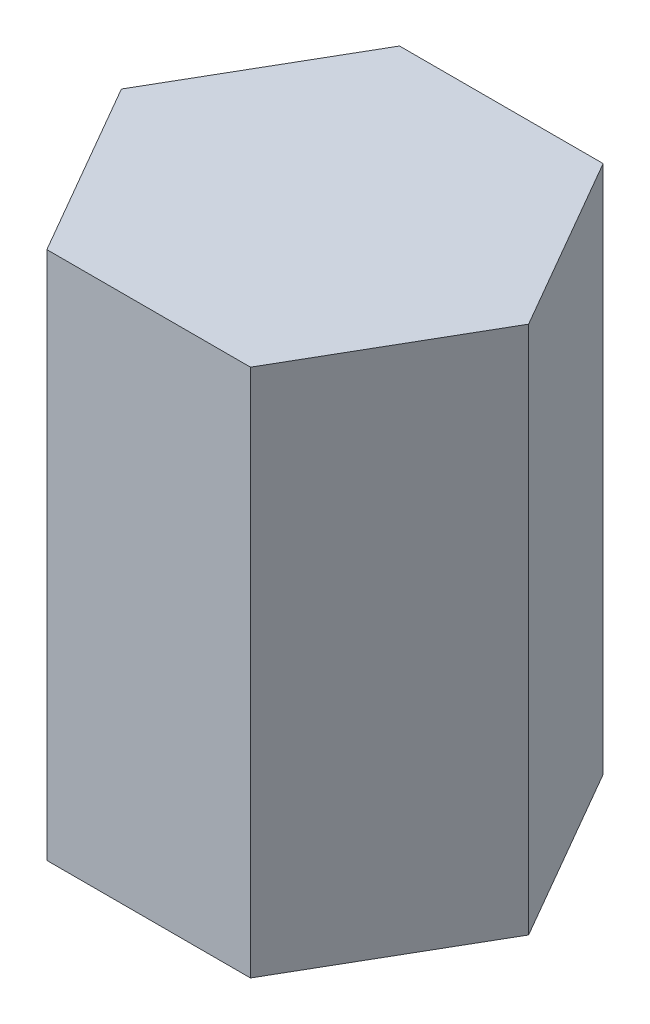
from build123d import *

# Parameters (mm, degrees)
EXTRUDE_1_DEPTH = 75


with BuildPart() as part:
    # 草图1 → 凸台-拉伸1 (new, symmetric)
    with BuildSketch(Plane(origin=(0, 0, 0), x_dir=(1, 0, 0), z_dir=(0, 1, 0))):
        Polygon((57.735026919, 0), (28.867513459, 50), (-28.867513459, 50), (-57.735026919, 0), (-28.867513459, -50), (28.867513459, -50), align=None)
    extrude(amount=EXTRUDE_1_DEPTH, both=True)


solid = part.part
